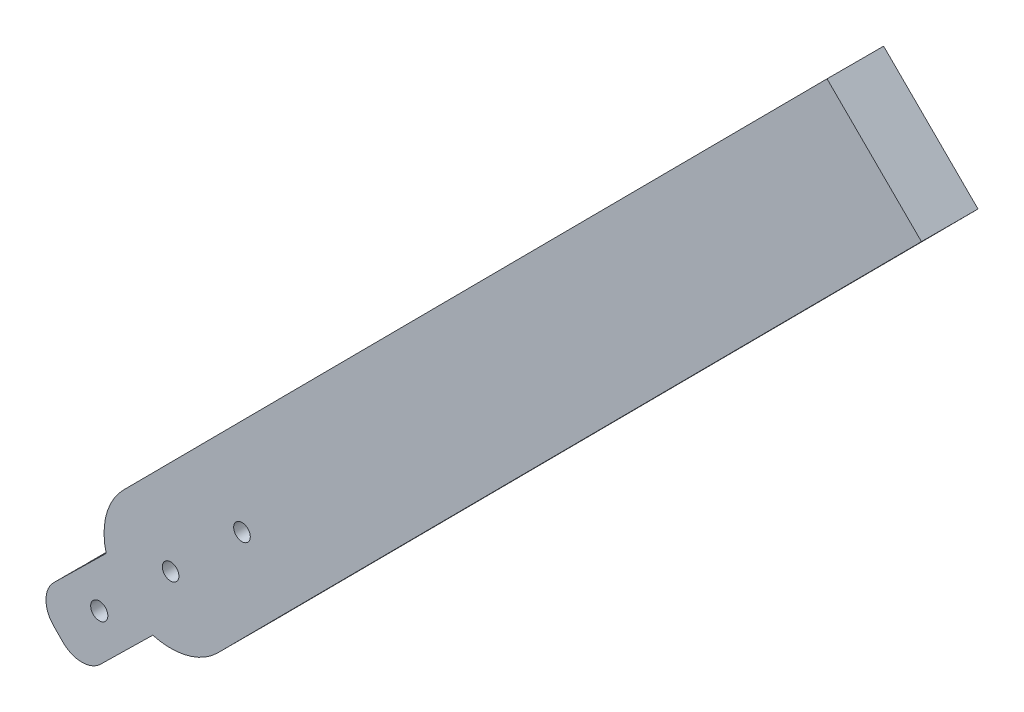
from build123d import *

# Parameters (mm, degrees)
EXTRUDE_1_DEPTH     = 17
SKETCH_2_R          = 2.5
CUT_EXTRUDE_1_DEPTH = 321.450895562
SKETCH_3_R          = 2.583506321
CUT_EXTRUDE_2_DEPTH = 321.450895562
SKETCH_4_W          = 3.2
SKETCH_4_H          = 25.526459387
SKETCH_4_H_2        = 4
CUT_EXTRUDE_3_DEPTH = 40
SKETCH_5_R          = 2.5
CUT_EXTRUDE_4_DEPTH = 321.450895562
SKETCH_7_W          = 3.2
SKETCH_7_H          = 45
CUT_EXTRUDE_5_DEPTH = 322.082013561
FILLET_1_R          = 5


with BuildPart() as part:
    # 草图1 → 凸台-拉伸1 (new body)
    with BuildSketch(Plane.XY):
        with BuildLine():
            Line((-14.185229692, 14.098909836), (14.185229692, -14.098909836))
            ThreePointArc((14.185229692, -14.098909836), (-14.098909836, -14.185229692), (-14.185229692, 14.098909836))
        make_face()
        Polygon((197.298417852, 226.877355223), (225.668877237, 198.67953555), (14.185229692, -14.098909836), (-14.185229692, 14.098909836), align=None)
        with BuildLine():
            Line((-19.366021875, -4.995717839), (-5.356592379, -19.269325834))
            Line((-5.356592379, -19.269325834), (-21.057561173, -34.67969828))
            ThreePointArc((-21.057561173, -34.67969828), (-26.736053935, -36.969906123), (-32.37077617, -34.57402688))
            Line((-32.37077617, -34.57402688), (-35.172662069, -31.719305281))
            ThreePointArc((-35.172662069, -31.719305281), (-37.462869912, -26.04081252), (-35.06699067, -20.406090285))
            Line((-35.06699067, -20.406090285), (-19.366021875, -4.995717839))
        make_face()
    extrude(amount=EXTRUDE_1_DEPTH)

    # 草图2 → 切除-拉伸1 (cut, through all)
    with BuildSketch(Plane.XY.offset(17)):
        Circle(SKETCH_2_R)
    extrude(amount=-CUT_EXTRUDE_1_DEPTH, mode=Mode.SUBTRACT)

    # 草图3 → 切除-拉伸2 (cut, through all)
    with BuildSketch(Plane.XY.offset(17)):
        with Locations((-21.446298181, -20.977518784)):
            Circle(SKETCH_3_R)
    extrude(amount=-CUT_EXTRUDE_2_DEPTH, mode=Mode.SUBTRACT)

    # 草图4 → 切除-拉伸3 (cut)
    with BuildSketch(Plane(origin=(-33.771719119, -33.146666081, 0), x_dir=(0, 0, 1), z_dir=(-0.7136803997395496, -0.7004714748136406, 0))):
        with Locations((8.5, -14.763229694)):
            Rectangle(SKETCH_4_W, SKETCH_4_H)
        with Locations((8.5, 14.763229694)):
            Rectangle(SKETCH_4_W, SKETCH_4_H)
        with Locations((8.5, 0)):
            Rectangle(SKETCH_4_W, SKETCH_4_H_2)
    extrude(amount=-CUT_EXTRUDE_3_DEPTH, mode=Mode.SUBTRACT)

    # 草图5 → 切除-拉伸4 (cut, through all)
    with BuildSketch(Plane.XY.offset(17)):
        with Locations((21.446298181, 20.977518784)):
            Circle(SKETCH_5_R)
    extrude(amount=-CUT_EXTRUDE_4_DEPTH, mode=Mode.SUBTRACT)

    # 草图7 → 切除-拉伸5 (cut, through all)
    with BuildSketch(Plane(origin=(-14.185229692, 14.098909836, 0), x_dir=(0, 0, 1), z_dir=(-0.7092614846225489, 0.7049454918155146, 0))):
        with Locations((8.5, 29.589308396)):
            Rectangle(SKETCH_7_W, SKETCH_7_H)
    extrude(amount=-CUT_EXTRUDE_5_DEPTH, mode=Mode.SUBTRACT)

    # 圆角1
    fillet_1_edges = [part.edges().sort_by_distance(p)[0] for p in [
        (50.905352818, 22.846030369, 8.5),
        (19.182805686, -9.070736439, 8.5),
        (-9.187653699, 19.127083234, 8.5),
        (22.534893433, 51.043850042, 8.5),
    ]]
    fillet(fillet_1_edges, radius=FILLET_1_R)


solid = part.part
